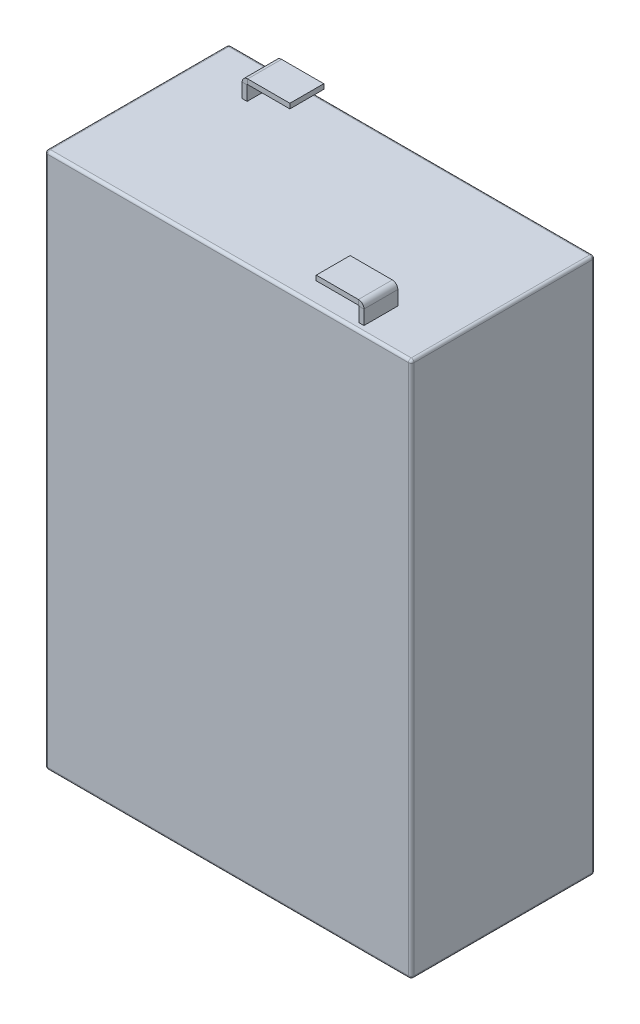
from build123d import *

# Parameters (mm, degrees)
SKETCH2_W           = 66.16954
SKETCH2_H           = 33.1978
BOSS_EXTRUDE1_DEPTH = 96.901
FILLET1_R           = 0.5
SKETCH3_W           = 0.889
SKETCH3_H           = 6.1214
CIRPATTERN1_COUNT   = 2


with BuildPart() as part:
    # Sketch2 → Boss-Extrude1 (new body)
    with BuildSketch(Plane(origin=(0, 0, 0), x_dir=(1, 0, 0), z_dir=(0, 1, 0))):
        Rectangle(SKETCH2_W, SKETCH2_H)
    extrude(amount=BOSS_EXTRUDE1_DEPTH)

    # Fillet1
    fillet1_edges = [part.edges().sort_by_distance(p)[0] for p in [
        (33.08477, 48.4505, 16.5989),
        (-33.08477, 48.4505, 16.5989),
        (-33.08477, 0, 0),
        (0, 0, 16.5989),
        (33.08477, 0, 0),
        (33.08477, 48.4505, -16.5989),
        (-33.08477, 48.4505, -16.5989),
        (0, 0, -16.5989),
        (0, 96.901, 16.5989),
        (-33.08477, 96.901, 0),
        (0, 96.901, -16.5989),
        (33.08477, 96.901, 0),
    ]]
    fillet(fillet1_edges, radius=FILLET1_R)

    # Sweep1: sweep along a path in Sketch4
    with BuildLine(Plane(origin=(0, 0, -16.5989), x_dir=(-1, 0, 0), z_dir=(0, 0, -1))) as sweep1_path:
        Line((23.25497, 96.901), (23.25497, 99.4824))
        ThreePointArc((23.25497, 99.4824), (22.962076781, 100.189506781), (22.25497, 100.4824))
        Line((22.25497, 100.4824), (14.63497, 100.4824))
    # Sketch3 → Sweep1 (sweep)
    with BuildSketch(Plane(origin=(0, 96.901, 0), x_dir=(1, 0, 0), z_dir=(0, 1, 0))):
        with Locations((-22.81047, 12.2532)):
            Rectangle(SKETCH3_W, SKETCH3_H)
    sweep1 = sweep(path=sweep1_path.line)

    # CirPattern1: Sweep1 ×2 about axis
    cirpattern1_axis = Axis((0, -5.02412, 0), (0, 1, 0))
    for i in range(1, CIRPATTERN1_COUNT):
        add(sweep1.rotate(cirpattern1_axis, i * 360 / CIRPATTERN1_COUNT))


solid = part.part
